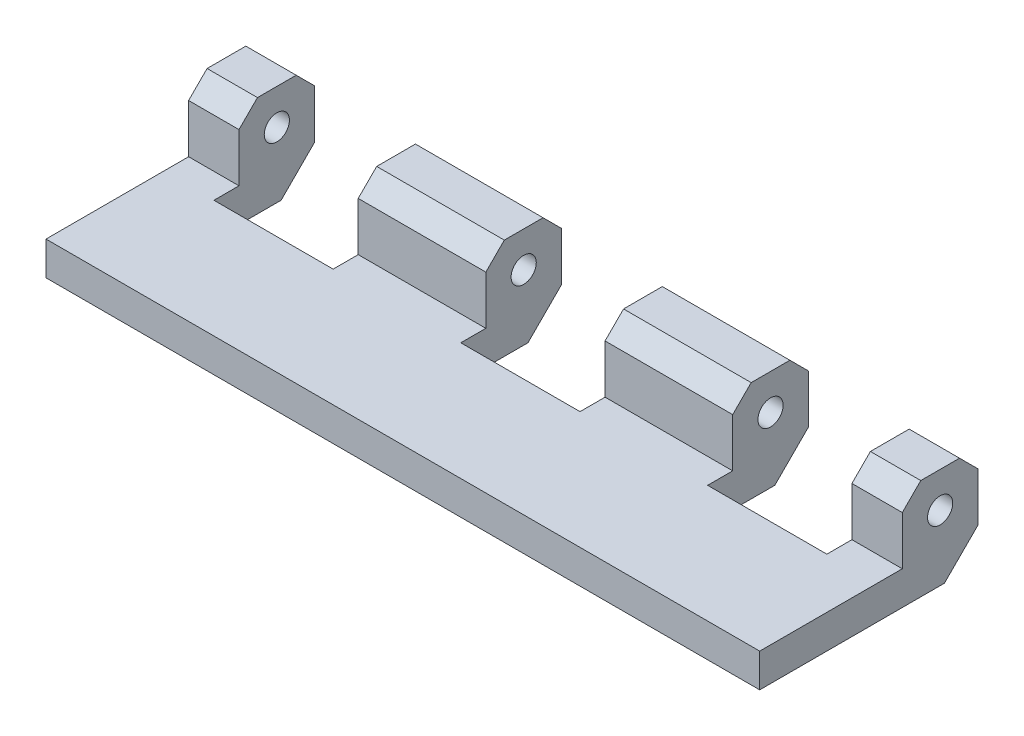
from build123d import *

# Parameters (mm, degrees)
SKETCH_1_W          = 85
SKETCH_1_H          = 26
EXTRUDE_1_DEPTH     = 12
SKETCH_2_W          = 19.106704299
SKETCH_2_H          = 9.017669608
CUT_EXTRUDE_1_DEPTH = 90.693923986
CHAMFER_1_SIZE      = 2.2
CHAMFER_2_SIZE      = 4
SKETCH_3_R          = 1.5
CUT_EXTRUDE_2_DEPTH = 90.693923986
SKETCH_4_W          = 14.2
SKETCH_4_H          = 12
CUT_EXTRUDE_3_DEPTH = 82.215762017


with BuildPart() as part:
    # Эскиз1 → Вытянуть1 (new body)
    with BuildSketch(Plane(origin=(0, 0, 0), x_dir=(1, 0, 0), z_dir=(0, 1, 0))):
        with Locations((33.5, -13)):
            Rectangle(SKETCH_1_W, SKETCH_1_H)
    extrude(amount=EXTRUDE_1_DEPTH)

    # Эскиз2 → Вырез-Вытянуть1 (cut, through all)
    with BuildSketch(Plane(origin=(76, 0, 0), x_dir=(0, 0, -1), z_dir=(1, 0, 0))):
        with Locations((-18.569613205, 8.508834804)):
            Rectangle(SKETCH_2_W, SKETCH_2_H)
    extrude(amount=-CUT_EXTRUDE_1_DEPTH, mode=Mode.SUBTRACT)

    # Фаска1
    chamfer_1_edges = [part.edges().sort_by_distance(p)[0] for p in [
        (33.5, 12, 0),
        (33.5, 12, 9.016261055),
    ]]
    chamfer(chamfer_1_edges, length=CHAMFER_1_SIZE)

    # Фаска2
    chamfer_2_edges = [part.edges().sort_by_distance(p)[0] for p in [
        (33.5, 0, 0),
    ]]
    chamfer(chamfer_2_edges, length=CHAMFER_2_SIZE)

    # Эскиз3 → Вырез-Вытянуть2 (cut, through all)
    with BuildSketch(Plane(origin=(76, 0, 0), x_dir=(0, 0, -1), z_dir=(1, 0, 0))):
        with Locations((-4.508130527, 7.777054312)):
            Circle(SKETCH_3_R)
    extrude(amount=-CUT_EXTRUDE_2_DEPTH, mode=Mode.SUBTRACT)

    # Эскиз4 → Вырез-Вытянуть3 (cut, through all)
    with BuildSketch(Plane(origin=(0, 12, 0), x_dir=(1, 0, 0), z_dir=(0, 1, 0))):
        with Locations((4.1, -6)):
            Rectangle(SKETCH_4_W, SKETCH_4_H)
        with Locations((62.9, -6)):
            Rectangle(SKETCH_4_W, SKETCH_4_H)
        with Locations((33.5, -6)):
            Rectangle(SKETCH_4_W, SKETCH_4_H)
    extrude(amount=-CUT_EXTRUDE_3_DEPTH, mode=Mode.SUBTRACT)


solid = part.part
